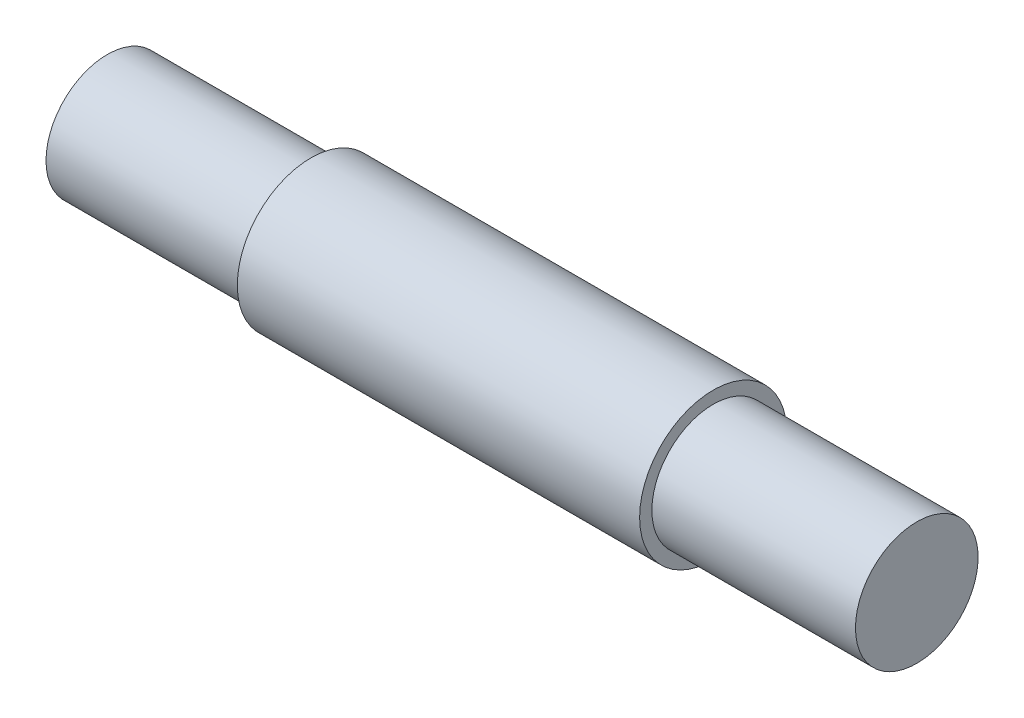
from build123d import *


with BuildPart() as part:
    # Sketch1 → Revolve2 (revolve)
    with BuildSketch(Plane(origin=(0, 0, 0), x_dir=(1, 0, 0), z_dir=(0, 1, 0)), mode=Mode.PRIVATE) as revolve2_sk:
        Polygon((-145.774647887, 0), (184.225352113, 0), (184.225352113, 25), (101.225352113, 25), (101.225352113, 30), (-62.774647887, 30), (-62.774647887, 25), (-145.774647887, 25), align=None)
    revolve(revolve2_sk.sketch.rotate(Axis((-145.774647887, 0, 0), (1, 0, 0)), 180), axis=Axis((-145.774647887, 0, 0), (1, 0, 0)))


solid = part.part
